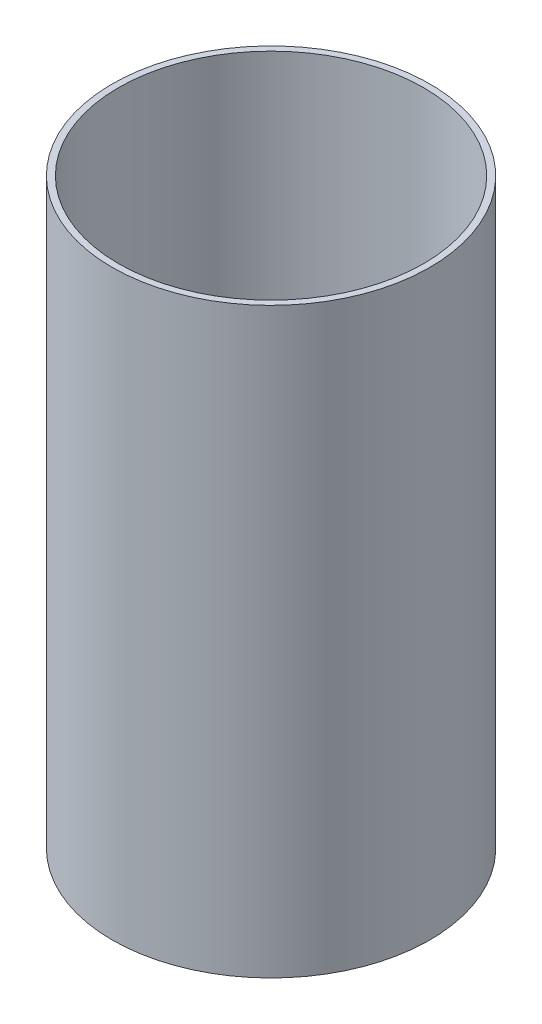
from build123d import *

# Parameters (mm, degrees)
SKETCH1_R           = 38.1
SKETCH1_R_2         = 36.576
BOSS_EXTRUDE1_DEPTH = 69.85


with BuildPart() as part:
    # Sketch1 → Boss-Extrude1 (new, symmetric)
    with BuildSketch(Plane(origin=(0, 0, 0), x_dir=(1, 0, 0), z_dir=(0, 1, 0))):
        with Locations(Location((0, 0, 0), (0, 0, 270))):
            Circle(SKETCH1_R)
        with Locations(Location((0, 0, 0), (0, 0, 270))):
            Circle(SKETCH1_R_2, mode=Mode.SUBTRACT)
    extrude(amount=BOSS_EXTRUDE1_DEPTH, both=True)


solid = part.part
